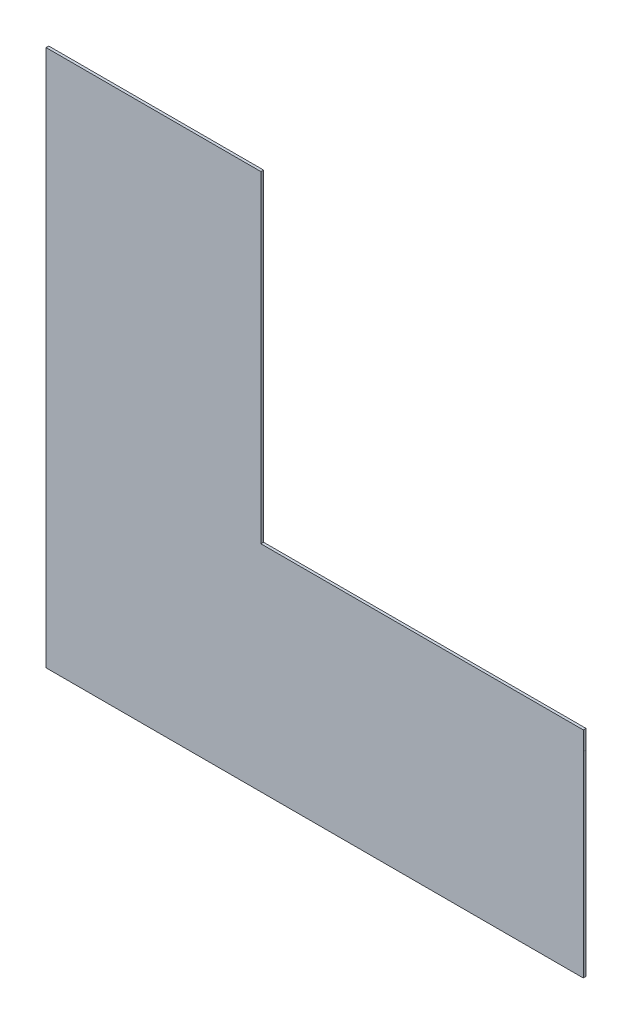
from build123d import *

# Parameters (mm, degrees)
BOSS_EXTRUDE1_DEPTH = 1


with BuildPart() as part:
    # Sketch1 → Boss-Extrude1 (new body)
    with BuildSketch(Plane.XY):
        Polygon((0, 0), (200, 0), (200, 80), (80, 80), (80, 200), (0, 200), align=None)
    extrude(amount=BOSS_EXTRUDE1_DEPTH)


solid = part.part
